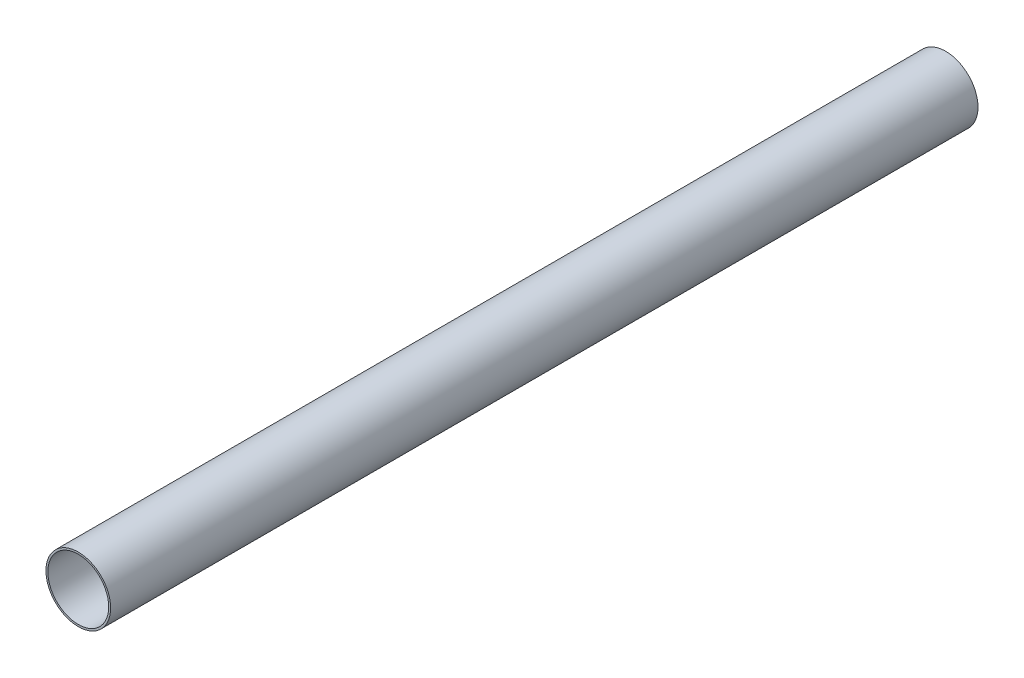
from build123d import *

# Parameters (mm, degrees)
SKETCH1_R           = 26.9875
SKETCH1_R_2         = 25.4
BOSS_EXTRUDE1_DEPTH = 723.9


with BuildPart() as part:
    # Sketch1 → Boss-Extrude1 (new body)
    with BuildSketch(Plane.XY):
        Circle(SKETCH1_R)
        Circle(SKETCH1_R_2, mode=Mode.SUBTRACT)
    extrude(amount=BOSS_EXTRUDE1_DEPTH)


solid = part.part
